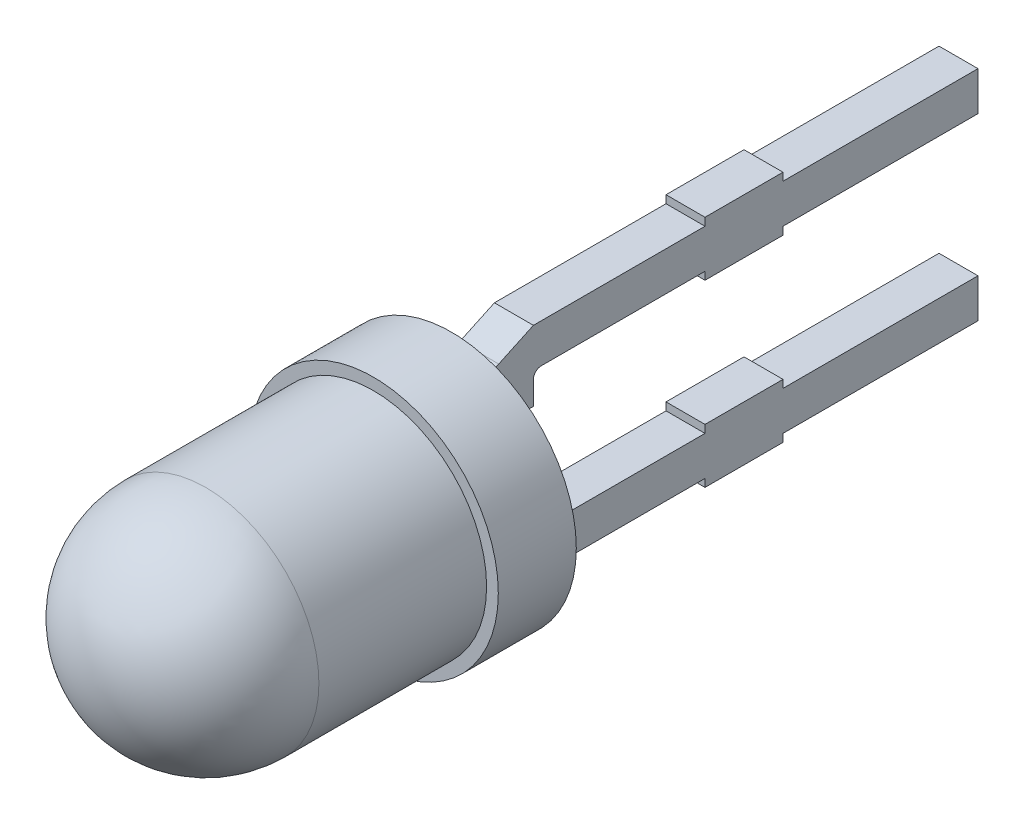
from build123d import *

# Parameters (mm, degrees)
EXTRUDE1_DEPTH          = 0.25
FILLET1_R               = 0.25
CUT_EXTRUDE1_DEPTH      = 31.234789562
CUT_EXTRUDE1_DEPTH_BACK = 31.234789562
SKETCH3_W               = 21.506924454
SKETCH3_H               = 6.886588263


with BuildPart() as part:
    # Sketch1 → Revolve1 (revolve)
    with BuildSketch(Plane(origin=(0, 0, 0), x_dir=(0, 0, -1), z_dir=(1, 0, 0)), mode=Mode.PRIVATE) as revolve1_sk:
        with BuildLine():
            Line((0, 1.45), (2.15, 1.45))
            Line((2.15, 1.45), (2.15, 1.599999975))
            Line((2.15, 1.599999975), (3.15, 1.599999975))
            Line((3.15, 1.599999975), (3.15, 0))
            Line((3.15, 0), (-1.45, 0))
            ThreePointArc((-1.45, 0), (-1.025304833, 1.025304833), (0, 1.45))
        make_face()
    revolve(revolve1_sk.sketch.rotate(Axis((0, 0, 0), (0, 0, -1)), 90), axis=Axis((0, 0, 0), (0, 0, -1)))

    # Sketch2 → Extrude1 (add, symmetric)
    with BuildSketch(Plane(origin=(0, 0, 0), x_dir=(0, 0, -1), z_dir=(1, 0, 0))):
        with BuildLine():
            Line((3.15, 1.026953873), (3.95, 1.4))
            Line((3.95, 1.4), (6.15, 1.4))
            Line((6.15, 1.4), (6.15, 1.5))
            Line((6.15, 1.5), (7.15, 1.5))
            Line((7.15, 1.5), (7.15, 1.4))
            Line((7.15, 1.4), (30.15, 1.4))
            Line((30.15, 1.4), (30.15, 0.9))
            Line((30.15, 0.9), (7.15, 0.9))
            Line((7.15, 0.9), (7.15, 0.8))
            Line((7.15, 0.8), (6.15, 0.8))
            Line((6.15, 0.8), (6.15, 0.9))
            Line((6.15, 0.9), (4.05, 0.9))
            ThreePointArc((4.05, 0.9), (3.979289322, 0.870710678), (3.95, 0.8))
            Line((3.95, 0.8), (3.95, 0.5))
            Line((3.95, 0.5), (3.15, 0.5))
            Line((3.15, 0.5), (3.15, 1.026953873))
        make_face()
        with BuildLine():
            Line((3.95, -0.8), (3.95, -0.5))
            Line((3.95, -0.5), (3.15, -0.5))
            Line((3.15, -0.5), (3.15, -1.026953873))
            Line((3.15, -1.026953873), (3.95, -1.4))
            Line((3.95, -1.4), (6.15, -1.4))
            Line((6.15, -1.4), (6.15, -1.5))
            Line((6.15, -1.5), (7.15, -1.5))
            Line((7.15, -1.5), (7.15, -1.4))
            Line((7.15, -1.4), (30.15, -1.4))
            Line((30.15, -1.4), (30.15, -0.9))
            Line((30.15, -0.9), (7.15, -0.9))
            Line((7.15, -0.9), (7.15, -0.8))
            Line((7.15, -0.8), (6.15, -0.8))
            Line((6.15, -0.8), (6.15, -0.9))
            Line((6.15, -0.9), (4.05, -0.9))
            ThreePointArc((4.05, -0.9), (3.979289322, -0.870710678), (3.95, -0.8))
        make_face()
    extrude(amount=EXTRUDE1_DEPTH, both=True)

    # Fillet1
    fillet1_edges = [part.edges().sort_by_distance(p)[0] for p in [
        (-0.25, 0.763476937, -3.15),
        (0, 1.026953873, -3.15),
        (0, 0.5, -3.15),
        (0.25, 0.763476937, -3.15),
        (-0.25, -0.763476937, -3.15),
        (0, -0.5, -3.15),
        (0, -1.026953873, -3.15),
        (0.25, -0.763476937, -3.15),
    ]]
    fillet(fillet1_edges, radius=FILLET1_R)

    # Sketch3 → Cut-Extrude1 (cut, two sides: drawn at the far end of the back side and taken through both)
    with BuildSketch(Plane(origin=(0, 0, 0), x_dir=(0, 0, -1), z_dir=(1, 0, 0)).offset(-CUT_EXTRUDE1_DEPTH_BACK)):
        with Locations((20.403462227, -0.013663866)):
            Rectangle(SKETCH3_W, SKETCH3_H)
    extrude(amount=CUT_EXTRUDE1_DEPTH + CUT_EXTRUDE1_DEPTH_BACK, mode=Mode.SUBTRACT)


solid = part.part
